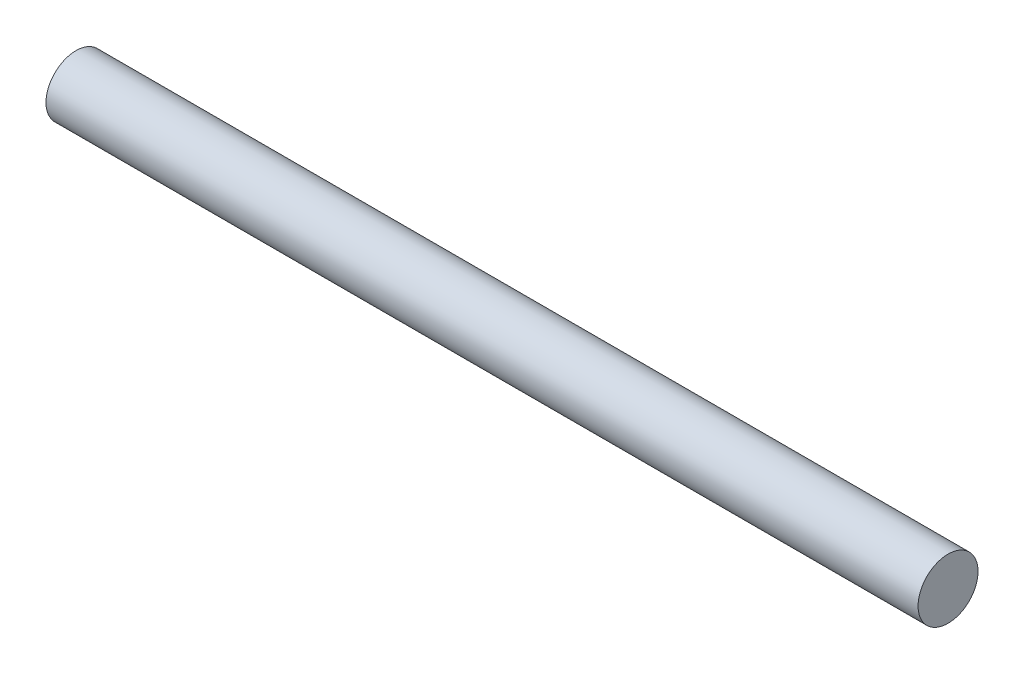
from build123d import *

# Parameters (mm, degrees)
SKETCH1_R           = 0.9975
BOSS_EXTRUDE1_DEPTH = 29


with BuildPart() as part:
    # Sketch1 → Boss-Extrude1 (new body)
    with BuildSketch(Plane(origin=(0, 0, 0), x_dir=(0, 0, -1), z_dir=(1, 0, 0))):
        with Locations(Location((0, 0, 0), (0, 0, 180))):
            Circle(SKETCH1_R)
    extrude(amount=BOSS_EXTRUDE1_DEPTH)


solid = part.part
